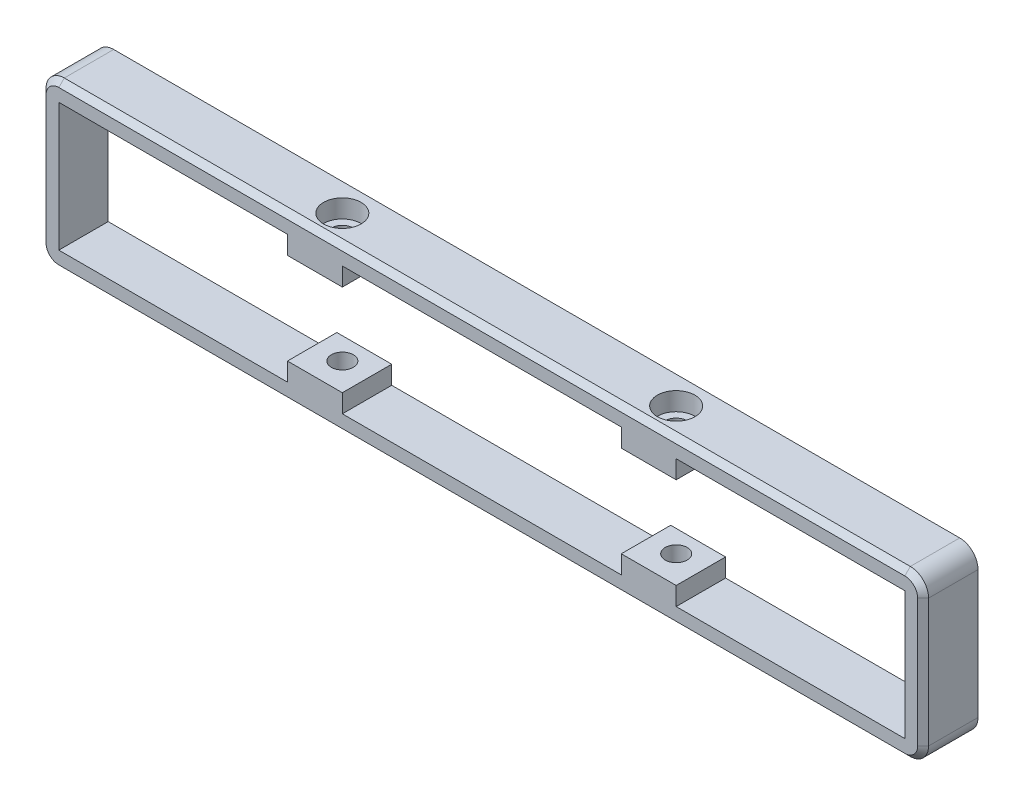
from build123d import *

# Parameters (mm, degrees)
SKETCH_1_W          = 96.5
SKETCH_1_H          = 18
SKETCH_1_W_2        = 92.5
SKETCH_1_H_2        = 14
EXTRUDE_1_DEPTH     = 6
FILLET_1_R          = 2
CHAMFER_1_SIZE      = 0.6
SKETCH_2_W          = 6
SKETCH_2_H          = 2
EXTRUDE_2_DEPTH     = 5.4
SKETCH_3_R          = 1.2
CUT_EXTRUDE_1_DEPTH = 52.846528331
SKETCH_4_R          = 2.05
CUT_EXTRUDE_2_DEPTH = 2
CUT_EXTRUDE_START   = -16
SKETCH_4_2_R        = 2.05
CUT_EXTRUDE_3_DEPTH = 2
CHAMFER_2_SIZE      = 0.6


with BuildPart() as part:
    # 草图1 → 凸台-拉伸1 (new body)
    with BuildSketch(Plane.XY):
        Rectangle(SKETCH_1_W, SKETCH_1_H)
        Rectangle(SKETCH_1_W_2, SKETCH_1_H_2, mode=Mode.SUBTRACT)
    extrude(amount=EXTRUDE_1_DEPTH)

    # 圆角1
    fillet_1_edges = [part.edges().sort_by_distance(p)[0] for p in [
        (48.25, -9, 3),
        (-48.25, -9, 3),
        (-48.25, 9, 3),
        (48.25, 9, 3),
    ]]
    fillet(fillet_1_edges, radius=FILLET_1_R)

    # 倒角1
    chamfer_1_edges = [part.edges().sort_by_distance(p)[0] for p in [
        (0, 7, 0),
        (-46.25, 0, 0),
        (0, -7, 0),
        (46.25, 0, 0),
    ]]
    chamfer(chamfer_1_edges, length=CHAMFER_1_SIZE)

    # 草图2 → 凸台-拉伸2 (add)
    with BuildSketch(Plane.XY.offset(6)):
        with Locations((-18.25, 6)):
            Rectangle(SKETCH_2_W, SKETCH_2_H)
        with Locations((-18.25, -6)):
            Rectangle(SKETCH_2_W, SKETCH_2_H)
        with Locations((18.25, 6)):
            Rectangle(SKETCH_2_W, SKETCH_2_H)
        with Locations((18.25, -6)):
            Rectangle(SKETCH_2_W, SKETCH_2_H)
    extrude(amount=-EXTRUDE_2_DEPTH)

    # 草图3 → 切除-拉伸1 (cut, through all)
    with BuildSketch(Plane(origin=(0, 9, 0), x_dir=(1, 0, 0), z_dir=(0, 1, 0))):
        with Locations(Location((-18.25, -3, 0), (0, 0, 270))):
            Circle(SKETCH_3_R)
        with Locations(Location((18.25, -3, 0), (0, 0, 270))):
            Circle(SKETCH_3_R)
    extrude(amount=-CUT_EXTRUDE_1_DEPTH, mode=Mode.SUBTRACT)

    # 草图4 → 切除-拉伸2 (cut)
    with BuildSketch(Plane(origin=(0, 9, 0), x_dir=(1, 0, 0), z_dir=(0, 1, 0))):
        with Locations(Location((-18.25, -3, 0), (0, 0, 270))):
            Circle(SKETCH_4_R)
        with Locations(Location((18.25, -3, 0), (0, 0, 270))):
            Circle(SKETCH_4_R)
    extrude(amount=-CUT_EXTRUDE_2_DEPTH, mode=Mode.SUBTRACT)

    # 草图4<2> → 切除-拉伸3 (cut)
    with BuildSketch(Plane(origin=(0, 9, 0), x_dir=(1, 0, 0), z_dir=(0, 1, 0)).offset(CUT_EXTRUDE_START)):
        with Locations(Location((-18.25, -3, 0), (0, 0, 270))):
            Circle(SKETCH_4_2_R)
        with Locations(Location((18.25, -3, 0), (0, 0, 270))):
            Circle(SKETCH_4_2_R)
    extrude(amount=-CUT_EXTRUDE_3_DEPTH, mode=Mode.SUBTRACT)

    # 倒角2
    chamfer_2_edges = [part.edges().sort_by_distance(p)[0] for p in [
        (0, -9, 6),
        (-48.25, 0, 6),
        (48.25, 0, 6),
        (0, 9, 6),
        (-47.664213562, 8.414213562, 6),
        (47.664213562, 8.414213562, 6),
        (47.664213562, -8.414213562, 6),
        (-47.664213562, -8.414213562, 6),
    ]]
    chamfer(chamfer_2_edges, length=CHAMFER_2_SIZE)


solid = part.part
